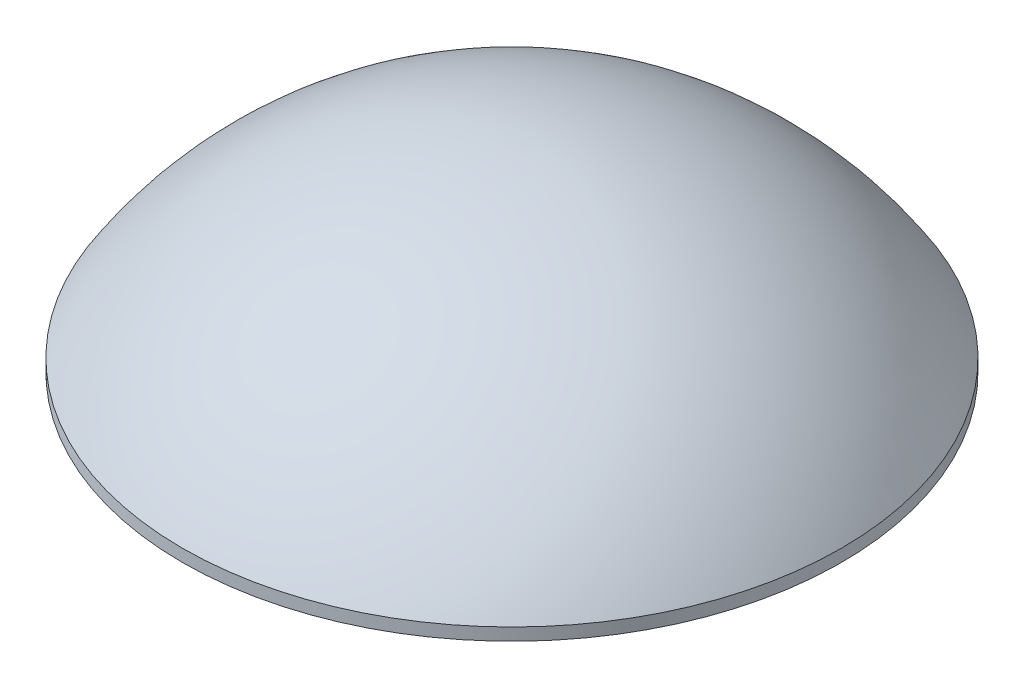
from build123d import *


with BuildPart() as part:
    # Sketch2 → Revolve4 (revolve)
    with BuildSketch(Plane.XY):
        with BuildLine():
            Line((-102.610915599, 79.818544211), (-102.610915599, 75.056044211))
            Line((-102.610915599, 75.056044211), (-127, 75.056044211))
            Line((-127, 75.056044211), (-127, 79.818544211))
            ThreePointArc((-127, 79.818544211), (-72.550735242, 131.287435864), (0, 150))
            Line((0, 150), (0, 130))
            ThreePointArc((0, 130), (-57.112123286, 116.782727206), (-102.610915599, 79.818544211))
        make_face()
    revolve(axis=Axis((0, 153.747197789, 0), (0, -1, 0)))


solid = part.part
